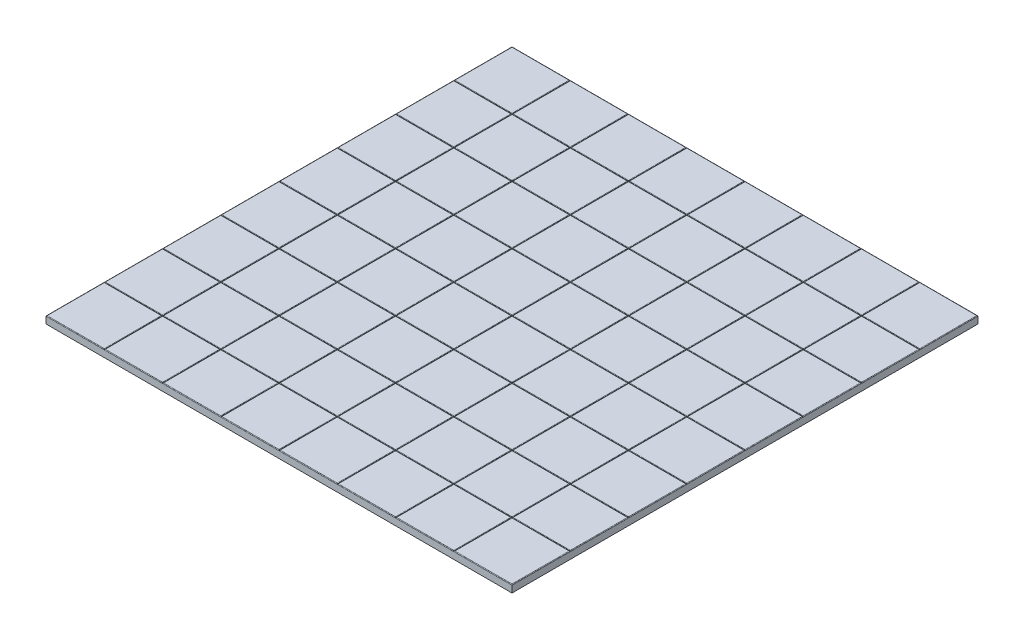
from build123d import *

# Parameters (mm, degrees)
SKETCH2_W           = 254
SKETCH2_H           = 254
BOSS_EXTRUDE1_DEPTH = 3.96875
CUT_EXTRUDE2_DEPTH  = 362.484068254
CUT_EXTRUDE3_DEPTH  = 417.609878635


with BuildPart() as part:
    # Sketch2 → Boss-Extrude1 (new body)
    with BuildSketch(Plane(origin=(0, 0, 0), x_dir=(1, 0, 0), z_dir=(0, 1, 0))):
        with Locations((127, 127)):
            Rectangle(SKETCH2_W, SKETCH2_H)
    extrude(amount=-BOSS_EXTRUDE1_DEPTH)

    # Sketch3 → Cut-Extrude2 (cut, through all)
    with BuildSketch(Plane.XY.offset(3.175)):
        with BuildLine():
            Line((-0.3175, 0), (0.3175, 0))
            ThreePointArc((0.3175, 0), (0.092993597, -0.092993597), (0, -0.3175))
            ThreePointArc((0, -0.3175), (-0.092993597, -0.092993597), (-0.3175, 0))
        make_face()
        with BuildLine():
            Line((31.4325, 0), (32.0675, 0))
            ThreePointArc((32.0675, 0), (31.842993597, -0.092993597), (31.75, -0.3175))
            ThreePointArc((31.75, -0.3175), (31.657006403, -0.092993597), (31.4325, 0))
        make_face()
        with BuildLine():
            Line((63.1825, 0), (63.8175, 0))
            ThreePointArc((63.8175, 0), (63.592993597, -0.092993597), (63.5, -0.3175))
            ThreePointArc((63.5, -0.3175), (63.407006403, -0.092993597), (63.1825, 0))
        make_face()
        with BuildLine():
            Line((94.9325, 0), (95.5675, 0))
            ThreePointArc((95.5675, 0), (95.342993597, -0.092993597), (95.25, -0.3175))
            ThreePointArc((95.25, -0.3175), (95.157006403, -0.092993597), (94.9325, 0))
        make_face()
        with BuildLine():
            Line((126.6825, 0), (127.3175, 0))
            ThreePointArc((127.3175, 0), (127.092993597, -0.092993597), (127, -0.3175))
            ThreePointArc((127, -0.3175), (126.907006403, -0.092993597), (126.6825, 0))
        make_face()
        with BuildLine():
            Line((158.4325, 0), (159.0675, 0))
            ThreePointArc((159.0675, 0), (158.842993597, -0.092993597), (158.75, -0.3175))
            ThreePointArc((158.75, -0.3175), (158.657006403, -0.092993597), (158.4325, 0))
        make_face()
        with BuildLine():
            Line((190.1825, 0), (190.8175, 0))
            ThreePointArc((190.8175, 0), (190.592993597, -0.092993597), (190.5, -0.3175))
            ThreePointArc((190.5, -0.3175), (190.407006403, -0.092993597), (190.1825, 0))
        make_face()
        with BuildLine():
            Line((221.9325, 0), (222.5675, 0))
            ThreePointArc((222.5675, 0), (222.342993597, -0.092993597), (222.25, -0.3175))
            ThreePointArc((222.25, -0.3175), (222.157006403, -0.092993597), (221.9325, 0))
        make_face()
        with BuildLine():
            Line((253.6825, 0), (254.3175, 0))
            ThreePointArc((254.3175, 0), (254.092993597, -0.092993597), (254, -0.3175))
            ThreePointArc((254, -0.3175), (253.907006403, -0.092993597), (253.6825, 0))
        make_face()
        with BuildLine():
            Line((285.4325, 0), (286.0675, 0))
            ThreePointArc((286.0675, 0), (285.842993597, -0.092993597), (285.75, -0.3175))
            ThreePointArc((285.75, -0.3175), (285.657006403, -0.092993597), (285.4325, 0))
        make_face()
        with BuildLine():
            Line((317.1825, 0), (317.8175, 0))
            ThreePointArc((317.8175, 0), (317.592993597, -0.092993597), (317.5, -0.3175))
            ThreePointArc((317.5, -0.3175), (317.407006403, -0.092993597), (317.1825, 0))
        make_face()
    extrude(amount=-CUT_EXTRUDE2_DEPTH, mode=Mode.SUBTRACT)

    # Sketch4 → Cut-Extrude3 (cut, through all)
    with BuildSketch(Plane(origin=(330.2, 0, 0), x_dir=(0, 0, -1), z_dir=(1, 0, 0))):
        with BuildLine():
            Line((31.4325, 0), (32.0675, 0))
            ThreePointArc((32.0675, 0), (31.842993597, -0.092993597), (31.75, -0.3175))
            ThreePointArc((31.75, -0.3175), (31.657006403, -0.092993597), (31.4325, 0))
        make_face()
        with BuildLine():
            Line((-0.3175, 0), (0.3175, 0))
            ThreePointArc((0.3175, 0), (0.092993597, -0.092993597), (0, -0.3175))
            ThreePointArc((0, -0.3175), (-0.092993597, -0.092993597), (-0.3175, 0))
        make_face()
        with BuildLine():
            Line((63.1825, 0), (63.8175, 0))
            ThreePointArc((63.8175, 0), (63.592993597, -0.092993597), (63.5, -0.3175))
            ThreePointArc((63.5, -0.3175), (63.407006403, -0.092993597), (63.1825, 0))
        make_face()
        with BuildLine():
            Line((94.9325, 0), (95.5675, 0))
            ThreePointArc((95.5675, 0), (95.342993597, -0.092993597), (95.25, -0.3175))
            ThreePointArc((95.25, -0.3175), (95.157006403, -0.092993597), (94.9325, 0))
        make_face()
        with BuildLine():
            Line((126.6825, 0), (127.3175, 0))
            ThreePointArc((127.3175, 0), (127.092993597, -0.092993597), (127, -0.3175))
            ThreePointArc((127, -0.3175), (126.907006403, -0.092993597), (126.6825, 0))
        make_face()
        with BuildLine():
            Line((158.4325, 0), (159.0675, 0))
            ThreePointArc((159.0675, 0), (158.842993597, -0.092993597), (158.75, -0.3175))
            ThreePointArc((158.75, -0.3175), (158.657006403, -0.092993597), (158.4325, 0))
        make_face()
        with BuildLine():
            Line((190.1825, 0), (190.8175, 0))
            ThreePointArc((190.8175, 0), (190.592993597, -0.092993597), (190.5, -0.3175))
            ThreePointArc((190.5, -0.3175), (190.407006403, -0.092993597), (190.1825, 0))
        make_face()
        with BuildLine():
            Line((221.9325, 0), (222.5675, 0))
            ThreePointArc((222.5675, 0), (222.342993597, -0.092993597), (222.25, -0.3175))
            ThreePointArc((222.25, -0.3175), (222.157006403, -0.092993597), (221.9325, 0))
        make_face()
        with BuildLine():
            Line((253.6825, 0), (254.3175, 0))
            ThreePointArc((254.3175, 0), (254.092993597, -0.092993597), (254, -0.3175))
            ThreePointArc((254, -0.3175), (253.907006403, -0.092993597), (253.6825, 0))
        make_face()
        with BuildLine():
            Line((285.4325, 0), (286.0675, 0))
            ThreePointArc((286.0675, 0), (285.842993597, -0.092993597), (285.75, -0.3175))
            ThreePointArc((285.75, -0.3175), (285.657006403, -0.092993597), (285.4325, 0))
        make_face()
        with BuildLine():
            Line((317.1825, 0), (317.8175, 0))
            ThreePointArc((317.8175, 0), (317.592993597, -0.092993597), (317.5, -0.3175))
            ThreePointArc((317.5, -0.3175), (317.407006403, -0.092993597), (317.1825, 0))
        make_face()
    extrude(amount=-CUT_EXTRUDE3_DEPTH, mode=Mode.SUBTRACT)


solid = part.part
